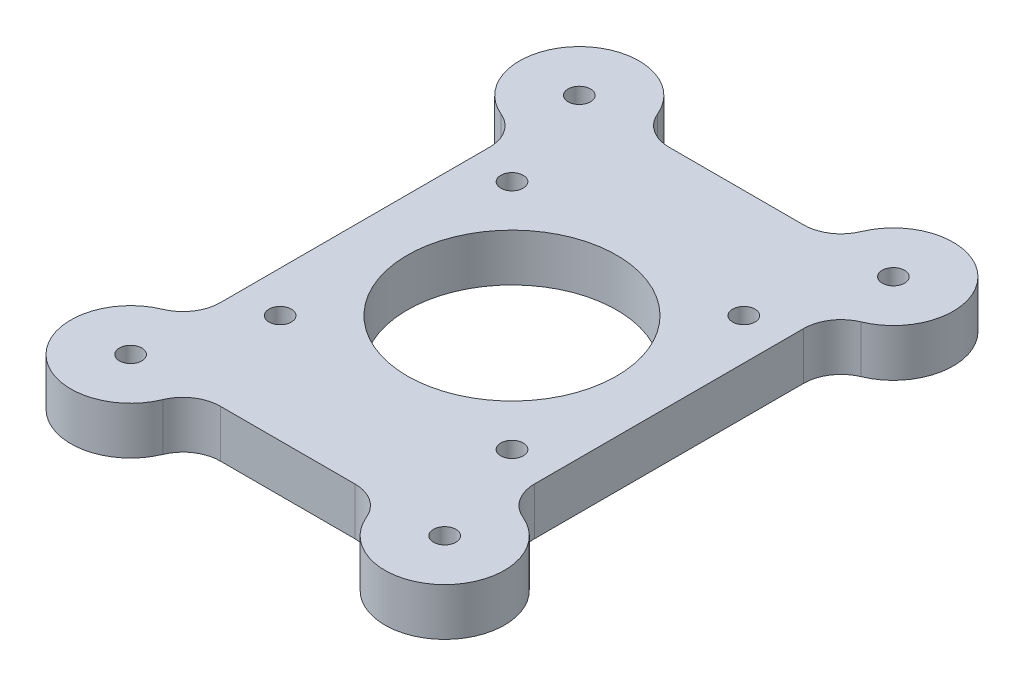
from build123d import *

# Parameters (mm, degrees)
SKETCH1_R           = 8
SKETCH1_W           = 42
SKETCH1_H           = 60
BOSS_EXTRUDE1_DEPTH = 6.35
SKETCH2_R           = 1.5
SKETCH2_R_2         = 14
CUT_EXTRUDE1_DEPTH  = 49.221597858
SKETCH3_R           = 1.5
CUT_EXTRUDE2_DEPTH  = 49.221597858
FILLET1_R           = 5


with BuildPart() as part:
    # Sketch1 → Boss-Extrude1 (new body)
    with BuildSketch(Plane(origin=(0, 0, 0), x_dir=(1, 0, 0), z_dir=(0, 1, 0))):
        with BuildLine():
            ThreePointArc((-21, -22), (-26.656854249, -35.656854249), (-13, -30))
            Line((-13, -30), (-21, -30))
            Line((-21, -30), (-21, -22))
        make_face()
        with BuildLine():
            Line((-21, -30), (-13, -30))
            ThreePointArc((-13, -30), (-15.343145751, -24.343145751), (-21, -22))
            Line((-21, -22), (-21, -30))
        make_face()
        with BuildLine():
            ThreePointArc((21, -22), (15.343145751, -24.343145751), (13, -30))
            Line((13, -30), (21, -30))
            Line((21, -30), (21, -22))
        make_face()
        with BuildLine():
            Line((21, -30), (13, -30))
            ThreePointArc((13, -30), (21, -38), (29, -30))
            ThreePointArc((29, -30), (26.656854249, -24.343145751), (21, -22))
            Line((21, -22), (21, -30))
        make_face()
        with Locations((21, -30)):
            Circle(SKETCH1_R)
        with Locations((21, 30)):
            Circle(SKETCH1_R)
        with Locations((-21, 30)):
            Circle(SKETCH1_R)
        with Locations((-21, -30)):
            Circle(SKETCH1_R)
        Rectangle(SKETCH1_W, SKETCH1_H)
        with BuildLine():
            ThreePointArc((13, 30), (15.343145751, 24.343145751), (21, 22))
            Line((21, 22), (21, 30))
            Line((21, 30), (13, 30))
        make_face()
        with BuildLine():
            Line((21, 30), (21, 22))
            ThreePointArc((21, 22), (26.656854249, 24.343145751), (29, 30))
            ThreePointArc((29, 30), (21, 38), (13, 30))
            Line((13, 30), (21, 30))
        make_face()
        with BuildLine():
            ThreePointArc((-13, 30), (-26.656854249, 35.656854249), (-21, 22))
            Line((-21, 22), (-21, 30))
            Line((-21, 30), (-13, 30))
        make_face()
        with BuildLine():
            Line((-21, 30), (-21, 22))
            ThreePointArc((-21, 22), (-15.343145751, 24.343145751), (-13, 30))
            Line((-13, 30), (-21, 30))
        make_face()
    extrude(amount=BOSS_EXTRUDE1_DEPTH)

    # Sketch2 → Cut-Extrude1 (cut, through all)
    with BuildSketch(Plane(origin=(0, 6.35, 0), x_dir=(1, 0, 0), z_dir=(0, 1, 0))):
        with Locations(Location((-15.5, -15.5, 0), (0, 0, 270))):
            Circle(SKETCH2_R)
        with Locations(Location((15.5, -15.5, 0), (0, 0, 270))):
            Circle(SKETCH2_R)
        with Locations(Location((15.5, 15.5, 0), (0, 0, 270))):
            Circle(SKETCH2_R)
        with Locations(Location((-15.5, 15.5, 0), (0, 0, 270))):
            Circle(SKETCH2_R)
        with Locations(Location((0, 0, 0), (0, 0, 270))):
            Circle(SKETCH2_R_2)
    extrude(amount=-CUT_EXTRUDE1_DEPTH, mode=Mode.SUBTRACT)

    # Sketch3 → Cut-Extrude2 (cut, through all)
    with BuildSketch(Plane(origin=(0, 6.35, 0), x_dir=(1, 0, 0), z_dir=(0, 1, 0))):
        with Locations(Location((-21, 30, 0), (0, 0, 270))):
            Circle(SKETCH3_R)
        with Locations(Location((21, 30, 0), (0, 0, 270))):
            Circle(SKETCH3_R)
        with Locations(Location((21, -30, 0), (0, 0, 270))):
            Circle(SKETCH3_R)
        with Locations(Location((-21, -30, 0), (0, 0, 270))):
            Circle(SKETCH3_R)
    extrude(amount=-CUT_EXTRUDE2_DEPTH, mode=Mode.SUBTRACT)

    # Fillet1
    fillet1_edges = [part.edges().sort_by_distance(p)[0] for p in [
        (13, 3.175, 30),
        (-13, 3.175, 30),
        (-21, 3.175, 22),
        (-21, 3.175, -22),
        (-13, 3.175, -30),
        (13, 3.175, -30),
        (21, 3.175, -22),
        (21, 3.175, 22),
    ]]
    fillet(fillet1_edges, radius=FILLET1_R)


solid = part.part
